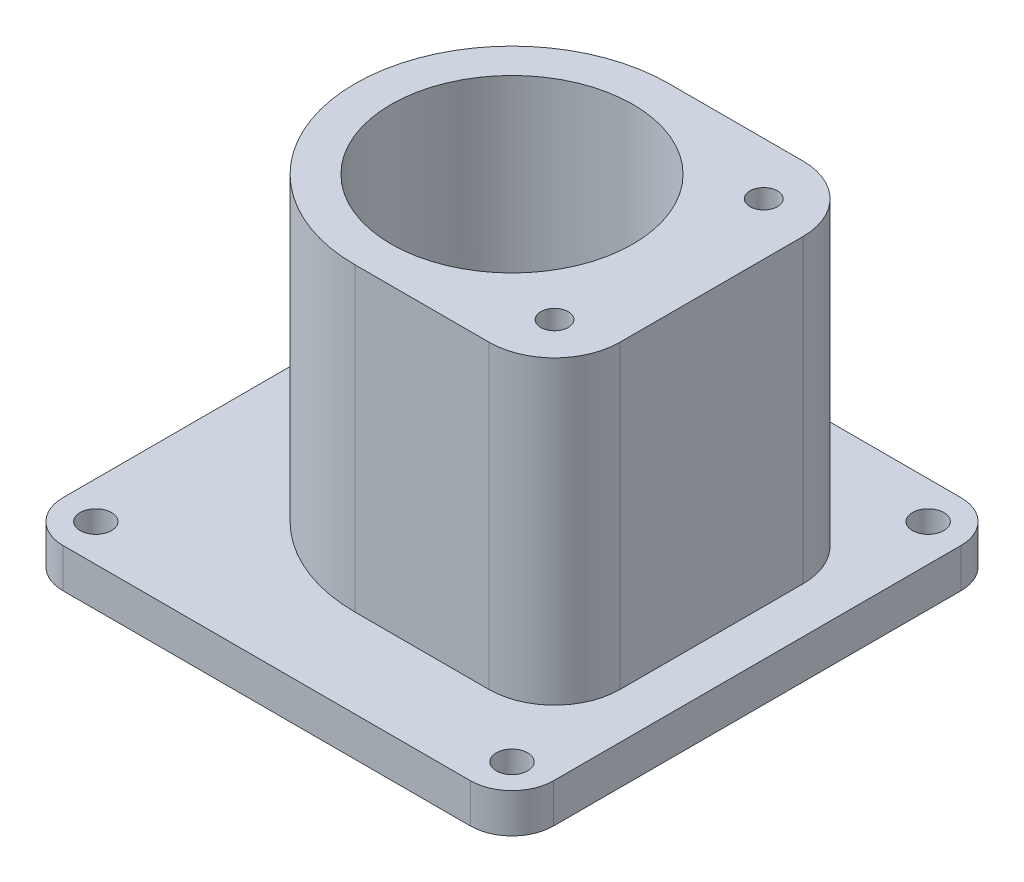
from build123d import *

# Parameters (mm, degrees)
SKETCH2_W                = 75
SKETCH2_H                = 75
SKETCH2_R                = 21
BOSS_EXTRUDE1_DEPTH      = 6
M4_CLEARANCE_HOLE1_D     = 4.8
M4_CLEARANCE_HOLE1_DEPTH = 25
FILLET1_R                = 6.35
SKETCH5_R                = 22.809118079
BOSS_EXTRUDE2_DEPTH      = 19
FILLET2_R                = 10
M5_TAPPED_HOLE1_D        = 4.2
M5_TAPPED_HOLE1_DEPTH    = 12.4
M5_TAPPED_HOLE1_TIP      = 1.2618073
SKETCH11_R               = 18.5
SKETCH11_R_2             = 2.1
BOSS_EXTRUDE3_DEPTH      = 27


with BuildPart() as part:
    # Sketch1 → Revolve1 (revolve)
    with BuildSketch(Plane.XY, mode=Mode.PRIVATE) as revolve1_sk:
        Polygon((-16.5, 0), (-34, 0), (-34, 6), (-24, 6), (-24, 25), (-18.5, 25), (-18.5, 13), (-16.5, 13), align=None)
    revolve(revolve1_sk.sketch.rotate(Axis((0, 0, 0), (0, 1, 0)), 270), axis=Axis((0, 0, 0), (0, 1, 0)))

    # Sketch2 → Boss-Extrude1 (add)
    with BuildSketch(Plane(origin=(0, 6, 0), x_dir=(1, 0, 0), z_dir=(0, 1, 0))):
        Rectangle(SKETCH2_W, SKETCH2_H)
        Circle(SKETCH2_R, mode=Mode.SUBTRACT)
    extrude(amount=-BOSS_EXTRUDE1_DEPTH)

    # M4 Clearance Hole1
    with Locations(Plane(origin=(0, 0, 0), x_dir=(-1, 0, 0), z_dir=(0, -1, 0))):
        with Locations((0, 0), (-31.819805153, 31.819805153), (31.819805153, 31.819805153), (31.819805153, -31.819805153), (-31.819805153, -31.819805153)):
            Hole(M4_CLEARANCE_HOLE1_D / 2, depth=M4_CLEARANCE_HOLE1_DEPTH)

    # Fillet1
    fillet1_edges = [part.edges().sort_by_distance(p)[0] for p in [
        (37.5, 3, 37.5),
        (37.5, 3, -37.5),
        (-37.5, 3, -37.5),
        (-37.5, 3, 37.5),
    ]]
    fillet(fillet1_edges, radius=FILLET1_R)

    # Sketch5 → Boss-Extrude2 (add)
    with BuildSketch(Plane(origin=(0, 25, 0), x_dir=(1, 0, 0), z_dir=(0, 1, 0))):
        with BuildLine():
            Line((0, 24), (6.5, 24))
            Line((6.5, 24), (30.5, 24))
            Line((30.5, 24), (30.5, -24))
            Line((30.5, -24), (6.5, -24))
            Line((6.5, -24), (0, -24))
            ThreePointArc((0, -24), (-24, 0), (0, 24))
        make_face()
        Circle(SKETCH5_R, mode=Mode.SUBTRACT)
    extrude(amount=-BOSS_EXTRUDE2_DEPTH)

    # Fillet2
    fillet2_edges = [part.edges().sort_by_distance(p)[0] for p in [
        (30.5, 15.5, -24),
        (30.5, 15.5, 24),
    ]]
    fillet(fillet2_edges, radius=FILLET2_R)

    # M5 Tapped Hole1
    with Locations(Plane(origin=(0, 25, 0), x_dir=(1, 0, 0), z_dir=(0, 1, 0))):
        with Locations((22.5, 16), (22.5, -16)):
            Hole(M5_TAPPED_HOLE1_D / 2, depth=M5_TAPPED_HOLE1_DEPTH)
            with Locations((0, 0, -(M5_TAPPED_HOLE1_DEPTH + M5_TAPPED_HOLE1_TIP / 2))):  # 118° drill point
                Cone(0, M5_TAPPED_HOLE1_D / 2, M5_TAPPED_HOLE1_TIP, mode=Mode.SUBTRACT)

    # Sketch11 → Boss-Extrude3 (add)
    with BuildSketch(Plane(origin=(0, 25, 0), x_dir=(1, 0, 0), z_dir=(0, 1, 0))):
        with BuildLine():
            Line((0, -24), (20.5, -24))
            ThreePointArc((20.5, -24), (27.571067812, -21.071067812), (30.5, -14))
            Line((30.5, -14), (30.5, 14))
            ThreePointArc((30.5, 14), (27.571067812, 21.071067812), (20.5, 24))
            Line((20.5, 24), (0, 24))
            ThreePointArc((0, 24), (-24, 0), (0, -24))
        make_face()
        with Locations(Location((0, 0, 0), (0, 0, 90))):
            Circle(SKETCH11_R, mode=Mode.SUBTRACT)
        with Locations(Location((22.5, -16, 0), (0, 0, 270))):
            Circle(SKETCH11_R_2, mode=Mode.SUBTRACT)
        with Locations(Location((22.5, 16, 0), (0, 0, 270))):
            Circle(SKETCH11_R_2, mode=Mode.SUBTRACT)
    extrude(amount=BOSS_EXTRUDE3_DEPTH)


solid = part.part
